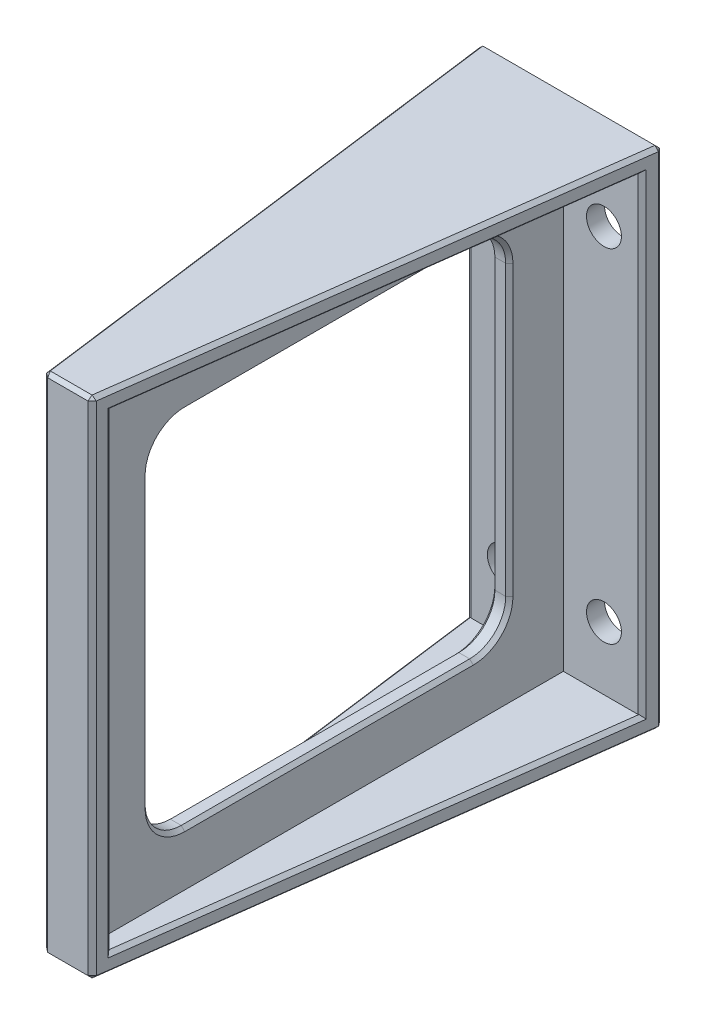
from build123d import *
from OCP.BRepFilletAPI import BRepFilletAPI_MakeChamfer

# Parameters (mm, degrees)
BOSS_EXTRUDE1_DEPTH      = 88.9
CUT_EXTRUDE2_DEPTH       = 130.67066939
CUT_EXTRUDE2_DEPTH_BACK  = 130.67066939
SKETCH12_W               = 127
SKETCH12_H               = 127
CUT_EXTRUDE3_START       = -3.175
SKETCH11_W               = 165.1
SKETCH11_H               = 165.1
CUT_EXTRUDE3_DEPTH       = 127.49566939
CUT_EXTRUDE4_START       = 3.175
SKETCH11_2_W             = 165.1
SKETCH11_2_H             = 165.1
CUT_EXTRUDE4_DEPTH       = 127.49566939
FILLET3_R                = 12.7
F_9_16_12_TAPPED_HOLE1_D = 12.30376
CHAMFER2_SIZE            = 1.27
CHAMFER2_SIZE2           = 1.132534886
CHAMFER2_SIZE2_2         = 1.47384677


with BuildPart() as part:
    # Sketch1 → Boss-Extrude1 (new, symmetric)
    with BuildSketch(Plane(origin=(0, 0, 0), x_dir=(-1, 0, 0), z_dir=(0, 1, 0))):
        Polygon((31.75, -88.9), (-31.75, -88.9), (-8.466666667, 88.9), (8.466666667, 88.9), align=None)
    extrude(amount=BOSS_EXTRUDE1_DEPTH, both=True)

    # Sketch12 → Cut-Extrude2 (cut, two sides: drawn at the far end of the back side and taken through both)
    with BuildSketch(Plane.YZ.offset(-CUT_EXTRUDE2_DEPTH_BACK)):
        Rectangle(SKETCH12_W, SKETCH12_H)
    extrude(amount=CUT_EXTRUDE2_DEPTH + CUT_EXTRUDE2_DEPTH_BACK, mode=Mode.SUBTRACT)

    # Sketch11 → Cut-Extrude3 (cut, through all)
    with BuildSketch(Plane.YZ.offset(CUT_EXTRUDE3_START)):
        Rectangle(SKETCH11_W, SKETCH11_H)
    extrude(amount=-CUT_EXTRUDE3_DEPTH, mode=Mode.SUBTRACT)

    # Sketch11<2> → Cut-Extrude4 (cut, through all)
    with BuildSketch(Plane.YZ.offset(CUT_EXTRUDE4_START)):
        Rectangle(SKETCH11_2_W, SKETCH11_2_H)
    extrude(amount=CUT_EXTRUDE4_DEPTH, mode=Mode.SUBTRACT)

    # Fillet3
    fillet3_edges = [part.edges().sort_by_distance(p)[0] for p in [
        (0, -63.5, 63.5),
        (0, 63.5, 63.5),
        (0, -63.5, -63.5),
        (0, 63.5, -63.5),
    ]]
    fillet(fillet3_edges, radius=FILLET3_R)

    # 9/16-12 Tapped Hole1 (through all)
    with Locations(Plane(origin=(0, 0, -88.9), x_dir=(1, 0, 0), z_dir=(0, 0, -1))):
        with Locations((-17.4625, 60.325), (17.4625, 60.325), (17.4625, -60.325), (-17.4625, -60.325)):
            Hole(F_9_16_12_TAPPED_HOLE1_D / 2)

    # Chamfer2: one chamfer whose edges measure the first distance from different faces: ONE call of the kernel's chamfer builder (chamfer() names one face for all edges)
    chamfer2_edges_1 = [part.edges().sort_by_distance(p)[0] for p in [
        (-3.175, -63.5, 0),
        (3.175, 0, -63.5),
        (-3.175, 0, -63.5),
        (3.175, 59.780256121, 59.780256121),
        (-3.175, 59.780256121, 59.780256121),
        (3.175, -59.780256121, 59.780256121),
        (-3.175, -59.780256121, 59.780256121),
        (3.175, -59.780256121, -59.780256121),
        (-3.175, -59.780256121, -59.780256121),
        (3.175, 59.780256121, -59.780256121),
        (-3.175, 59.780256121, -59.780256121),
        (0, 88.9, -88.9),
        (20.108333333, 88.9, 0),
        (-20.108333333, -82.55, 0),
        (-20.108333333, 82.55, 0),
        (0, 88.9, 88.9),
        (20.108333333, -88.9, 0),
        (0, -88.9, -88.9),
        (-20.108333333, -88.9, 0),
        (0, -88.9, 88.9),
        (20.108333333, -82.55, 0),
        (20.108333333, 82.55, 0),
        (-20.108333333, 88.9, 0),
        (3.175, 0, 63.5),
        (-3.175, 0, 63.5),
        (3.175, 63.5, 0),
        (-3.175, 63.5, 0),
        (3.175, -63.5, 0),
    ]]
    chamfer2_edges_2 = [part.edges().sort_by_distance(p)[0] for p in [
        (-9.298214286, 0, 82.55),
    ]]
    chamfer2_side_2 = [part.faces().sort_by_distance(p)[0] for p in [
        (-8.794551937, 0, 86.396148844),
    ]]
    chamfer2_edges_3 = [part.edges().sort_by_distance(p)[0] for p in [
        (-30.918452381, 0, -82.55),
        (-8.466666667, 0, 88.9),
    ]]
    chamfer2_side_3 = [part.faces().sort_by_distance(p)[0] for p in [
        (-8.794551937, 0, 86.396148844),
    ]]
    chamfer2_edges_4 = [part.edges().sort_by_distance(p)[0] for p in [
        (30.918452381, 0, -82.55),
    ]]
    chamfer2_side_4 = [part.faces().sort_by_distance(p)[0] for p in [
        (20.108333333, -86.374771424, 0),
    ]]
    chamfer2_edges_5 = [part.edges().sort_by_distance(p)[0] for p in [
        (9.298214286, 0, 82.55),
        (31.75, 0, -88.9),
    ]]
    chamfer2_side_5 = [part.faces().sort_by_distance(p)[0] for p in [
        (20.108333333, -86.374771424, 0),
    ]]
    chamfer2_edges_6 = [part.edges().sort_by_distance(p)[0] for p in [
        (8.466666667, 0, 88.9),
    ]]
    chamfer2_side_6 = [part.faces().sort_by_distance(p)[0] for p in [
        (0, 0, 88.9),
    ]]
    chamfer2_edges_7 = [part.edges().sort_by_distance(p)[0] for p in [
        (-31.75, 0, -88.9),
    ]]
    chamfer2_side_7 = [part.faces().sort_by_distance(p)[0] for p in [
        (0, 0, -88.9),
    ]]
    chamfer2 = BRepFilletAPI_MakeChamfer(part.part.solid().wrapped)
    for e in chamfer2_edges_1:
        chamfer2.Add(CHAMFER2_SIZE, e.wrapped)
    for e in chamfer2_edges_2:
        chamfer2.Add(CHAMFER2_SIZE, CHAMFER2_SIZE2, e.wrapped, chamfer2_side_2[0].wrapped)  # the first distance lies on this face
    for e in chamfer2_edges_3:
        chamfer2.Add(CHAMFER2_SIZE, CHAMFER2_SIZE2_2, e.wrapped, chamfer2_side_3[0].wrapped)  # the first distance lies on this face
    for e in chamfer2_edges_4:
        chamfer2.Add(CHAMFER2_SIZE, CHAMFER2_SIZE2_2, e.wrapped, chamfer2_side_4[0].wrapped)  # the first distance lies on this face
    for e in chamfer2_edges_5:
        chamfer2.Add(CHAMFER2_SIZE, CHAMFER2_SIZE2, e.wrapped, chamfer2_side_5[0].wrapped)  # the first distance lies on this face
    for e in chamfer2_edges_6:
        chamfer2.Add(CHAMFER2_SIZE, CHAMFER2_SIZE2_2, e.wrapped, chamfer2_side_6[0].wrapped)  # the first distance lies on this face
    for e in chamfer2_edges_7:
        chamfer2.Add(CHAMFER2_SIZE, CHAMFER2_SIZE2, e.wrapped, chamfer2_side_7[0].wrapped)  # the first distance lies on this face
    add(Compound.cast(chamfer2.Shape()), mode=Mode.REPLACE)


solid = part.part
